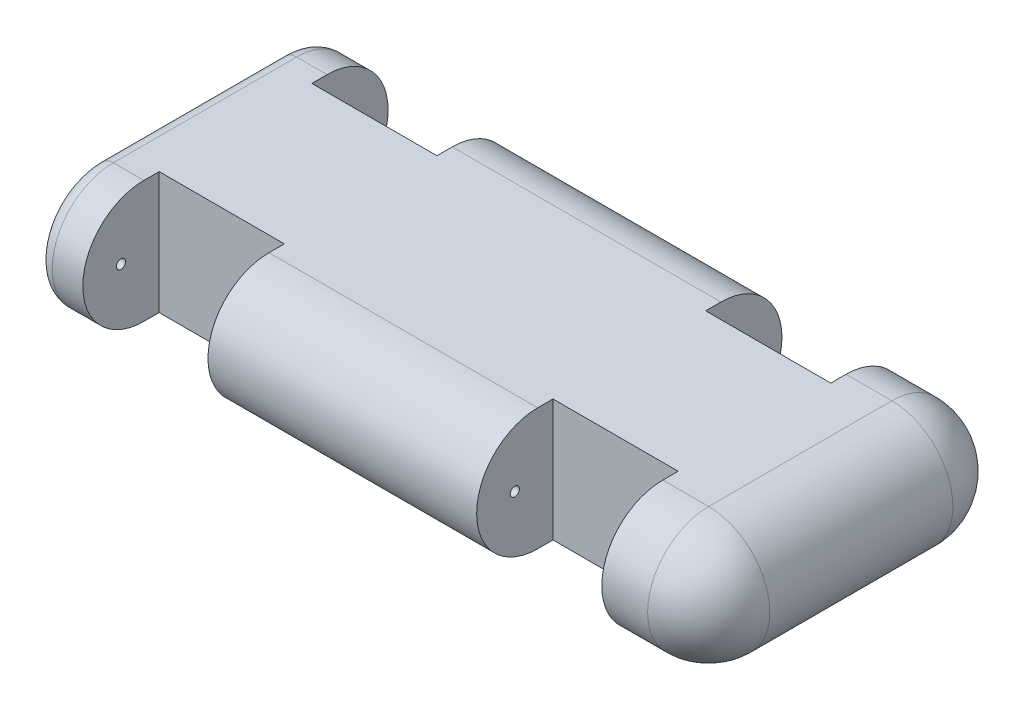
from build123d import *

# Parameters (mm, degrees)
BOSS_EXTRUDE1_DEPTH     = 40
CUT_EXTRUDE1_DEPTH      = 308.480080656
CUT_EXTRUDE1_DEPTH_BACK = 308.480080656
SKETCH2_R               = 3
CUT_EXTRUDE2_DEPTH      = 308.480080656
CUT_EXTRUDE2_DEPTH_BACK = 308.480080656
SKETCH3_R               = 3
CUT_EXTRUDE3_DEPTH      = 415.246303544
CUT_EXTRUDE3_DEPTH_BACK = 415.246303544
CUT_EXTRUDE4_DEPTH      = 415.246303544
CUT_EXTRUDE4_DEPTH_BACK = 415.246303544
BOSS_EXTRUDE3_DEPTH     = 60
REVOLVE1_ANGLE          = 90
FILLET1_R               = 10


with BuildPart() as part:
    # Sketch1 → Boss-Extrude1 (new, symmetric)
    with BuildSketch(Plane(origin=(0, 0, 0), x_dir=(1, 0, 0), z_dir=(0, 1, 0))):
        Polygon((-200, 100), (-170, 100), (-170, 50), (-88, 50), (-88, 100), (88, 100), (88, 50), (170, 50), (170, 100), (200, 100), (200, -100), (170, -100), (170, -50), (88, -50), (88, -100), (-88, -100), (-88, -50), (-170, -50), (-170, -100), (-200, -100), align=None)
    extrude(amount=BOSS_EXTRUDE1_DEPTH, both=True)

    # Sketch2 → Cut-Extrude1 (cut, two sides: drawn at the far end of the back side and taken through both)
    with BuildSketch(Plane.ZY.offset(88).offset(-CUT_EXTRUDE1_DEPTH_BACK)):
        with Locations((-75, 0)):
            Circle(SKETCH2_R)
    extrude(amount=CUT_EXTRUDE1_DEPTH + CUT_EXTRUDE1_DEPTH_BACK, mode=Mode.SUBTRACT)

    # Sketch3 → Cut-Extrude2 (cut, two sides: drawn at the far end of the back side and taken through both)
    with BuildSketch(Plane.ZY.offset(88).offset(-CUT_EXTRUDE2_DEPTH_BACK)):
        with Locations((75, 0)):
            Circle(SKETCH3_R)
    extrude(amount=CUT_EXTRUDE2_DEPTH + CUT_EXTRUDE2_DEPTH_BACK, mode=Mode.SUBTRACT)

    # Sketch4 → Cut-Extrude3 (cut, two sides: drawn at the far end of the back side and taken through both)
    with BuildSketch(Plane.ZY.offset(200).offset(-CUT_EXTRUDE3_DEPTH_BACK)):
        with BuildLine():
            Line((-60, -40), (-60, -70.289993794))
            Line((-60, -70.289993794), (-136.864216991, -70.289993794))
            Line((-136.864216991, -70.289993794), (-136.864216991, 63.942219024))
            Line((-136.864216991, 63.942219024), (-60, 63.942219024))
            Line((-60, 63.942219024), (-60, 40))
            ThreePointArc((-60, 40), (-100, 0), (-60, -40))
        make_face()
    extrude(amount=CUT_EXTRUDE3_DEPTH + CUT_EXTRUDE3_DEPTH_BACK, mode=Mode.SUBTRACT)

    # Sketch5 → Cut-Extrude4 (cut, two sides: drawn at the far end of the back side and taken through both)
    with BuildSketch(Plane.ZY.offset(200).offset(-CUT_EXTRUDE4_DEPTH_BACK)):
        with BuildLine():
            Line((60, -40), (60, -76.328121014))
            Line((60, -76.328121014), (141.05428579, -76.328121014))
            Line((141.05428579, -76.328121014), (141.05428579, 68.89657982))
            Line((141.05428579, 68.89657982), (60, 68.89657982))
            Line((60, 68.89657982), (60, 40))
            ThreePointArc((60, 40), (100, 0), (60, -40))
        make_face()
    extrude(amount=CUT_EXTRUDE4_DEPTH + CUT_EXTRUDE4_DEPTH_BACK, mode=Mode.SUBTRACT)

    # Sketch7 → Boss-Extrude3 (add, symmetric)
    with BuildSketch(Plane.XY):
        with BuildLine():
            Line((200, 40), (200, -40))
            ThreePointArc((200, -40), (240, 0), (200, 40))
        make_face()
    extrude(amount=BOSS_EXTRUDE3_DEPTH, both=True)

    # Sketch8 → Revolve1 (revolve)
    with BuildSketch(Plane.XY.offset(60)):
        with BuildLine():
            Line((200, 40), (200, -40))
            ThreePointArc((200, -40), (240, 0), (200, 40))
        make_face()
    revolve1 = revolve(axis=Axis((200, 40, 60), (0, -1, 0)), revolution_arc=REVOLVE1_ANGLE)

    # Mirror1: Revolve1 across plane
    add(revolve1.mirror(Plane.XY))

    # Fillet1
    fillet1_edges = [part.edges().sort_by_distance(p)[0] for p in [
        (-200, 0, 100),
        (-200, -40, 0),
        (-200, 40, 0),
        (-200, 0, -100),
    ]]
    fillet(fillet1_edges, radius=FILLET1_R)


solid = part.part
